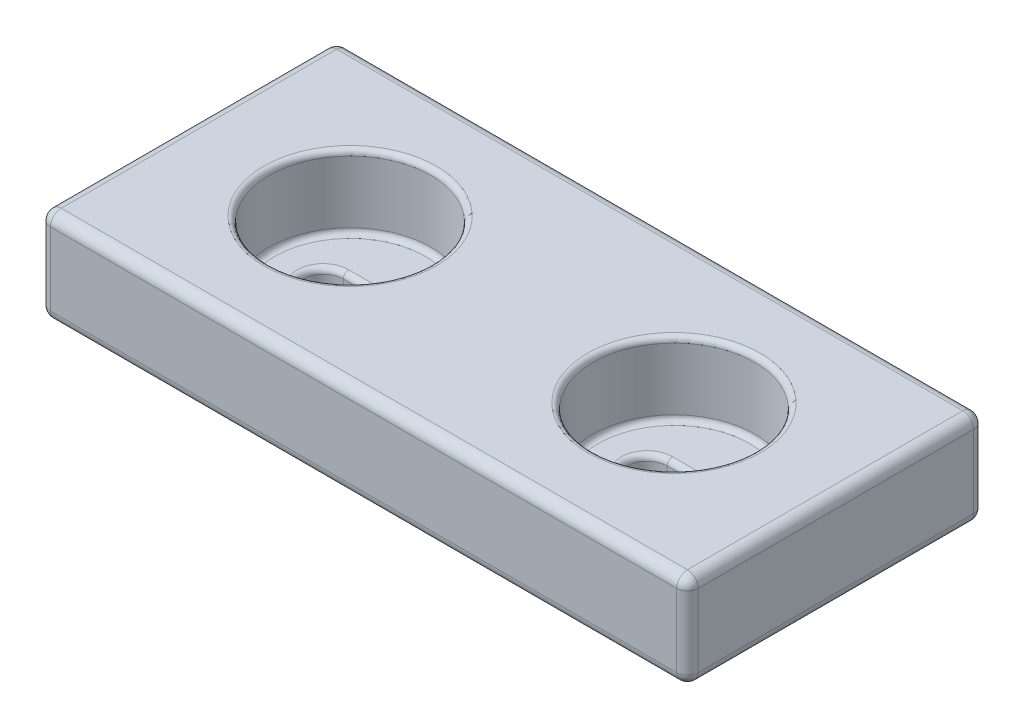
from build123d import *

# Parameters (mm, degrees)
SKETCH1_W           = 152.4
SKETCH1_H           = 69.85
BOSS_EXTRUDE1_DEPTH = 22.225
FILLET1_R           = 2.54
SKETCH3_R           = 19.05
CUT_EXTRUDE1_DEPTH  = 17.145
CUT_EXTRUDE2_DEPTH  = 87.718776802
FILLET2_R           = 1.27


with BuildPart() as part:
    # Sketch1 → Boss-Extrude1 (new body)
    with BuildSketch(Plane(origin=(0, 0, 0), x_dir=(1, 0, 0), z_dir=(0, 1, 0))):
        Rectangle(SKETCH1_W, SKETCH1_H)
    extrude(amount=BOSS_EXTRUDE1_DEPTH)

    # Fillet1
    fillet1_edges = [part.edges().sort_by_distance(p)[0] for p in [
        (76.2, 22.225, 0),
        (0, 22.225, -34.925),
        (-76.2, 22.225, 0),
        (0, 0, -34.925),
        (76.2, 0, 0),
        (0, 0, 34.925),
        (-76.2, 0, 0),
        (0, 22.225, 34.925),
        (-76.2, 11.1125, -34.925),
        (76.2, 11.1125, -34.925),
        (76.2, 11.1125, 34.925),
        (-76.2, 11.1125, 34.925),
    ]]
    fillet(fillet1_edges, radius=FILLET1_R)

    # Sketch3 → Cut-Extrude1 (cut)
    with BuildSketch(Plane(origin=(0, 22.225, 0), x_dir=(1, 0, 0), z_dir=(0, 1, 0))):
        with Locations(Location((-38.1, 0, 0), (0, 0, 270))):
            Circle(SKETCH3_R)
        with Locations(Location((38.1, 0, 0), (0, 0, 270))):
            Circle(SKETCH3_R)
    extrude(amount=-CUT_EXTRUDE1_DEPTH, mode=Mode.SUBTRACT)

    # Sketch4 → Cut-Extrude2 (cut, through all)
    with BuildSketch(Plane(origin=(0, 22.225, 0), x_dir=(1, 0, 0), z_dir=(0, 1, 0))):
        with BuildLine():
            Line((-31.75, -4.7625), (-44.45, -4.7625))
            ThreePointArc((-44.45, -4.7625), (-49.2125, 0), (-44.45, 4.7625))
            Line((-44.45, 4.7625), (-31.75, 4.7625))
            ThreePointArc((-31.75, 4.7625), (-26.9875, 0), (-31.75, -4.7625))
        make_face()
        with BuildLine():
            Line((44.45, -4.7625), (31.75, -4.7625))
            ThreePointArc((31.75, -4.7625), (26.9875, 0), (31.75, 4.7625))
            Line((31.75, 4.7625), (44.45, 4.7625))
            ThreePointArc((44.45, 4.7625), (49.2125, 0), (44.45, -4.7625))
        make_face()
    extrude(amount=-CUT_EXTRUDE2_DEPTH, mode=Mode.SUBTRACT)

    # Fillet2
    fillet2_edges = [part.edges().sort_by_distance(p)[0] for p in [
        (-38.1, 22.225, -19.05),
        (-38.1, 5.08, -19.05),
        (38.1, 22.225, -19.05),
        (38.1, 5.08, -19.05),
        (-38.1, 5.08, -4.7625),
        (-49.2125, 5.08, 0),
        (-38.1, 5.08, 4.7625),
        (-26.9875, 5.08, 0),
        (-26.9875, 0, 0),
        (-38.1, 0, 4.7625),
        (-49.2125, 0, 0),
        (-38.1, 0, -4.7625),
        (38.1, 5.08, -4.7625),
        (26.9875, 5.08, 0),
        (38.1, 5.08, 4.7625),
        (49.2125, 5.08, 0),
        (49.2125, 0, 0),
        (38.1, 0, 4.7625),
        (26.9875, 0, 0),
        (38.1, 0, -4.7625),
    ]]
    fillet(fillet2_edges, radius=FILLET2_R)


solid = part.part
